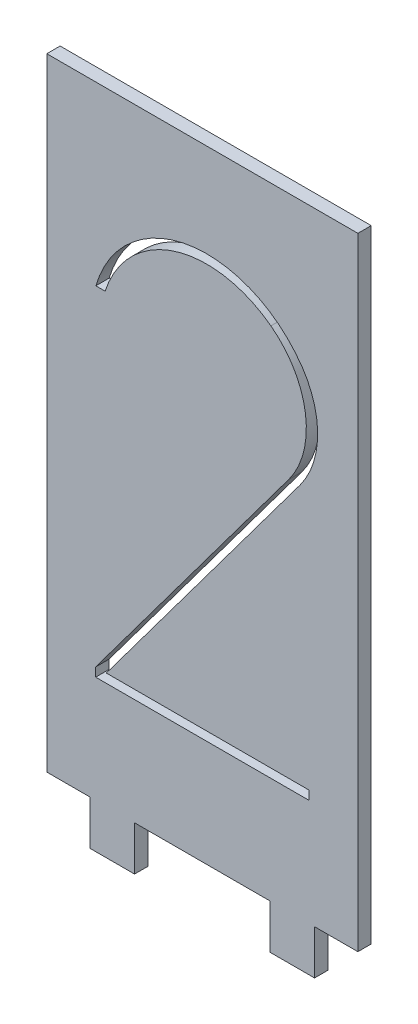
from build123d import *

# Parameters (mm, degrees)
SKIZZE1_W                        = 35
SKIZZE1_H                        = 75
AUFSATZ_LINEAR_AUSTRAGEN1_DEPTH  = 1.5
SKIZZE3_W                        = 15.25
SKIZZE3_H                        = 5
SKIZZE3_W_2                      = 4.875
SCHNITT_LINEAR_AUSTRAGEN12_DEPTH = 20
SCHNITT_LINEAR_AUSTRAGEN14_DEPTH = 1.5
VERRUNDUNG1_R                    = 10
VERRUNDUNG2_R                    = 10


with BuildPart() as part:
    # Skizze1 → Aufsatz-Linear austragen1 (new body)
    with BuildSketch(Plane.XY):
        with Locations((17.5, 37.5)):
            Rectangle(SKIZZE1_W, SKIZZE1_H)
    extrude(amount=AUFSATZ_LINEAR_AUSTRAGEN1_DEPTH)

    # Skizze3 → Schnitt-Linear austragen12 (cut)
    with BuildSketch(Plane.XY.offset(1.5)):
        with Locations((17.5, 2.5)):
            Rectangle(SKIZZE3_W, SKIZZE3_H)
        with Locations((32.5625, 2.5)):
            Rectangle(SKIZZE3_W_2, SKIZZE3_H)
        with Locations((2.4375, 2.5)):
            Rectangle(SKIZZE3_W_2, SKIZZE3_H)
    extrude(amount=-SCHNITT_LINEAR_AUSTRAGEN12_DEPTH, mode=Mode.SUBTRACT)

    # Skizze7 → Schnitt-Linear austragen14 (cut)
    with BuildSketch(Plane.XY.offset(1.5)):
        with BuildLine():
            Line((29.980893063, 50.823094237), (5.5, 18))
            Line((5.5, 18), (5.5, 17))
            Line((5.5, 17), (29.5, 17))
            Line((29.5, 17), (29.5, 18))
            Line((29.5, 18), (6.7, 18))
            Line((6.7, 18), (30.963924784, 50.532191031))
            ThreePointArc((30.963924784, 50.532191031), (20.317920223, 64.291686591), (5.520765623, 55.142623967))
            Line((5.520765623, 55.142623967), (6.566221507, 55.142623967))
            ThreePointArc((6.566221507, 55.142623967), (20.177020409, 63.300872092), (29.980893063, 50.823094237))
        make_face()
    extrude(amount=-SCHNITT_LINEAR_AUSTRAGEN14_DEPTH, mode=Mode.SUBTRACT)

    # Verrundung1
    verrundung1_edges = [part.edges().sort_by_distance(p)[0] for p in [
        (30.963924784, 50.532191031, 0.75),
    ]]
    fillet(verrundung1_edges, radius=VERRUNDUNG1_R)

    # Verrundung2
    verrundung2_edges = [part.edges().sort_by_distance(p)[0] for p in [
        (29.980893063, 50.823094237, 0.75),
    ]]
    fillet(verrundung2_edges, radius=VERRUNDUNG2_R)


solid = part.part
